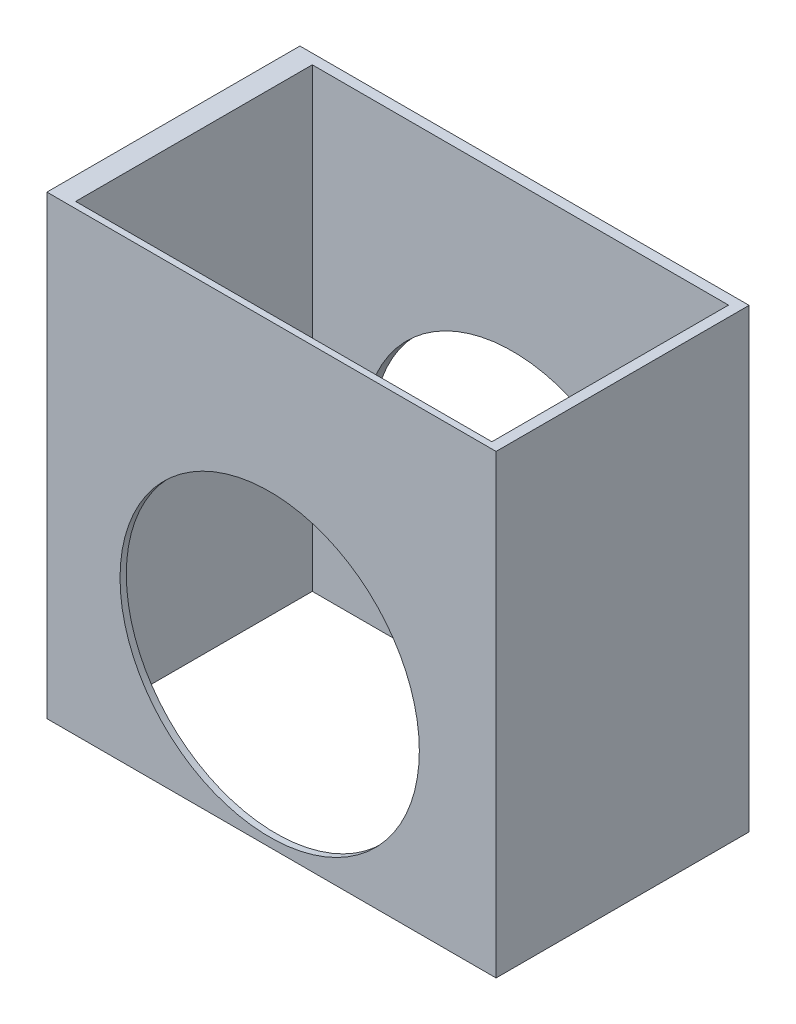
from build123d import *

# Parameters (mm, degrees)
SKETCH1_W           = 23.898976307
SKETCH1_H           = 24.263846175
BOSS_EXTRUDE3_DEPTH = 13.462
SKETCH2_R           = 7.962435276
CUT_EXTRUDE1_DEPTH  = 35.56
SKETCH3_W           = 22.145451027
SKETCH3_H           = 12.591550695
CUT_EXTRUDE2_DEPTH  = 167.64


with BuildPart() as part:
    # Sketch1 → Boss-Extrude3 (new body)
    with BuildSketch(Plane.XY):
        with Locations((-11.949488154, 12.131923088)):
            Rectangle(SKETCH1_W, SKETCH1_H)
    extrude(amount=BOSS_EXTRUDE3_DEPTH)

    # Sketch2 → Cut-Extrude1 (cut)
    with BuildSketch(Plane.XY.offset(13.462)):
        with Locations((-12.046046864, 8.430505839)):
            Circle(SKETCH2_R)
    extrude(amount=-CUT_EXTRUDE1_DEPTH, mode=Mode.SUBTRACT)

    # Sketch3 → Cut-Extrude2 (cut)
    with BuildSketch(Plane(origin=(0, 24.263846175, 0), x_dir=(1, 0, 0), z_dir=(0, 1, 0))):
        with Locations((-11.63102481, -6.83187996)):
            Rectangle(SKETCH3_W, SKETCH3_H)
    extrude(amount=-CUT_EXTRUDE2_DEPTH, mode=Mode.SUBTRACT)


solid = part.part
